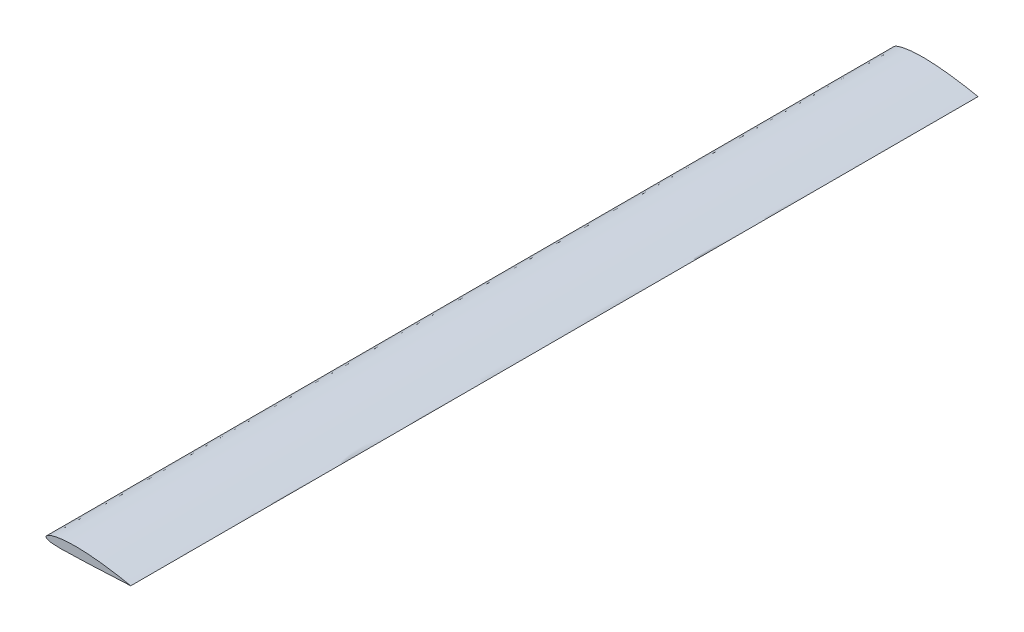
from build123d import *

# Parameters (mm, degrees)
BOSS_EXTRUDE1_DEPTH = 5000


with BuildPart() as part:
    # Sketch1 → Boss-Extrude1 (new, symmetric)
    with BuildSketch(Plane.XY):
        with BuildLine():
            add(Edge.make_bspline(
                [(1000, 0), (1000.008732575, 0.119934673), (994.187328475, 1.095784731), (988.251348446, 2.665278865), (973.684466483, 5.605552362), (955.704193065, 9.406804905), (932.033845609, 14.148821253), (903.907868573, 19.585849032), (871.265367886, 25.620094404), (834.559796689, 32.025101031), (794.153237065, 38.635008087), (750.483589178, 45.284490242), (704.028186518, 51.782042159), (655.278036723, 57.952618949), (604.766905697, 63.636654415), (553.045039244, 68.679616497), (500.687139828, 72.918485351), (448.263577724, 76.207167966), (396.21846862, 78.532292844), (345.123763577, 79.394025154), (295.5885467, 78.617376502), (248.347738408, 76.226280652), (203.946254759, 72.333427292), (162.919560592, 67.058846851), (125.725576031, 60.617089261), (92.812975019, 53.187501619), (64.520492058, 45.061214649), (41.146737262, 36.464635167), (22.82569661, 27.701447857), (9.699666673, 18.845558343), (1.40290372, 9.922481264), (-1.11984119, -0.134704317), (3.756551554, -9.27363119), (13.896645859, -15.902451596), (28.549172986, -21.436262672), (48.045688358, -25.888027759), (72.211329883, -29.344441639), (100.845694496, -31.808139969), (133.643960932, -33.305691521), (170.270650663, -33.93362889), (210.333575175, -33.771921588), (253.434927087, -32.956870104), (299.134351362, -31.676805698), (346.987948532, -30.036471481), (396.648680131, -28.29666423), (447.622383274, -26.415912735), (499.3540949, -24.177442288), (551.152474125, -21.765469822), (602.440968269, -19.273153211), (652.660327747, -16.79973851), (701.265859538, -14.38782564), (747.72341067, -12.125039109), (791.51871415, -9.984428896), (832.158044684, -8.035277352), (869.187695267, -6.274087529), (902.214420858, -4.702046353), (930.744197997, -3.33301569), (954.810833725, -2.203233614), (973.142478811, -1.249941335), (987.981344419, -0.70571823), (994.084917377, -0.103818704), (999.99123792, -0.120339889), (1000, 0)],
                knots=[0, 0, 0, 0, 0.001356704, 0.005435364, 0.012160549, 0.021476208, 0.033268728, 0.047418304, 0.063767275, 0.082120564, 0.102301326, 0.124060299, 0.147173611, 0.171379884, 0.196425271, 0.222028151, 0.247908738, 0.273780804, 0.299380281, 0.324625528, 0.349026459, 0.37232564, 0.394271214, 0.414650832, 0.433225344, 0.449841401, 0.464318215, 0.476543577, 0.486486469, 0.494145336, 0.499780476, 0.504095444, 0.508406034, 0.514028804, 0.521614067, 0.53140824, 0.543410468, 0.55754631, 0.573715744, 0.591754562, 0.611488784, 0.632713723, 0.655239764, 0.678816014, 0.703228825, 0.72841996, 0.75393564, 0.779484896, 0.804785932, 0.829557187, 0.853532458, 0.876455339, 0.898055921, 0.918107706, 0.936370203, 0.952661985, 0.966766836, 0.978537418, 0.987850678, 0.994569087, 0.998638712, 1, 1, 1, 1], degree=3))
        make_face()
    extrude(amount=BOSS_EXTRUDE1_DEPTH, both=True)


solid = part.part
